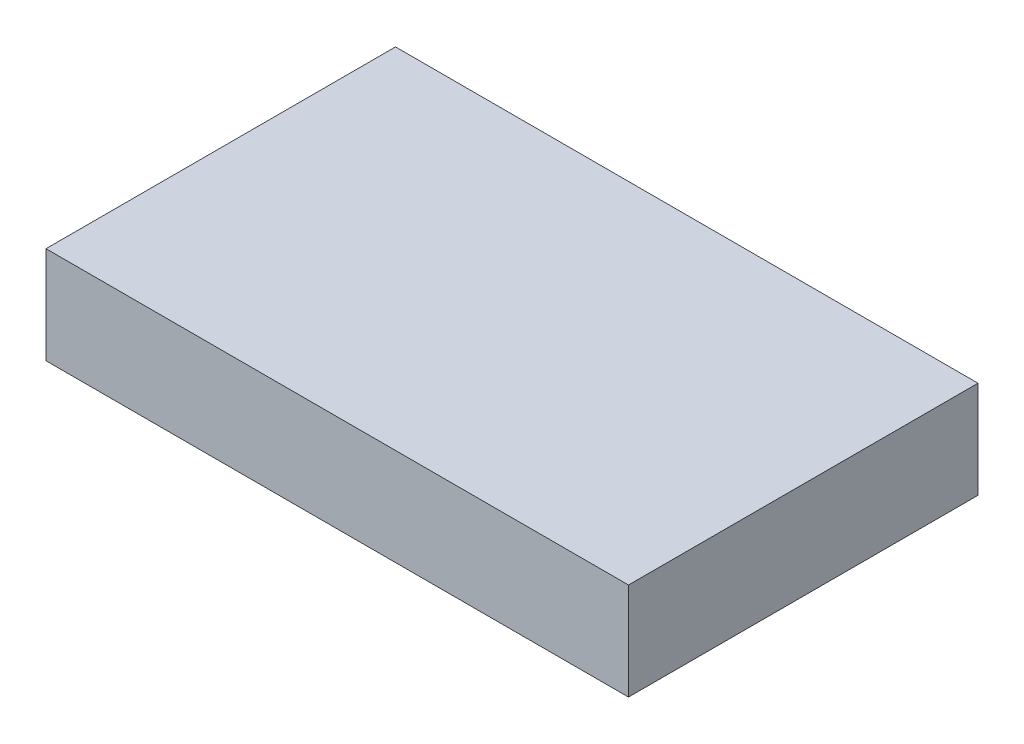
from build123d import *

# Parameters (mm, degrees)
SKETCH_1_W                        = 150
SKETCH_1_H                        = 25
V2_REF_ELECTRONICS_ENVELOPE_DEPTH = 90


with BuildPart() as part:
    # 草图1 → V2_REF_electronics_envelope (new body)
    with BuildSketch(Plane.XY):
        with Locations((75, 12.5)):
            Rectangle(SKETCH_1_W, SKETCH_1_H)
    extrude(amount=V2_REF_ELECTRONICS_ENVELOPE_DEPTH)


solid = part.part
